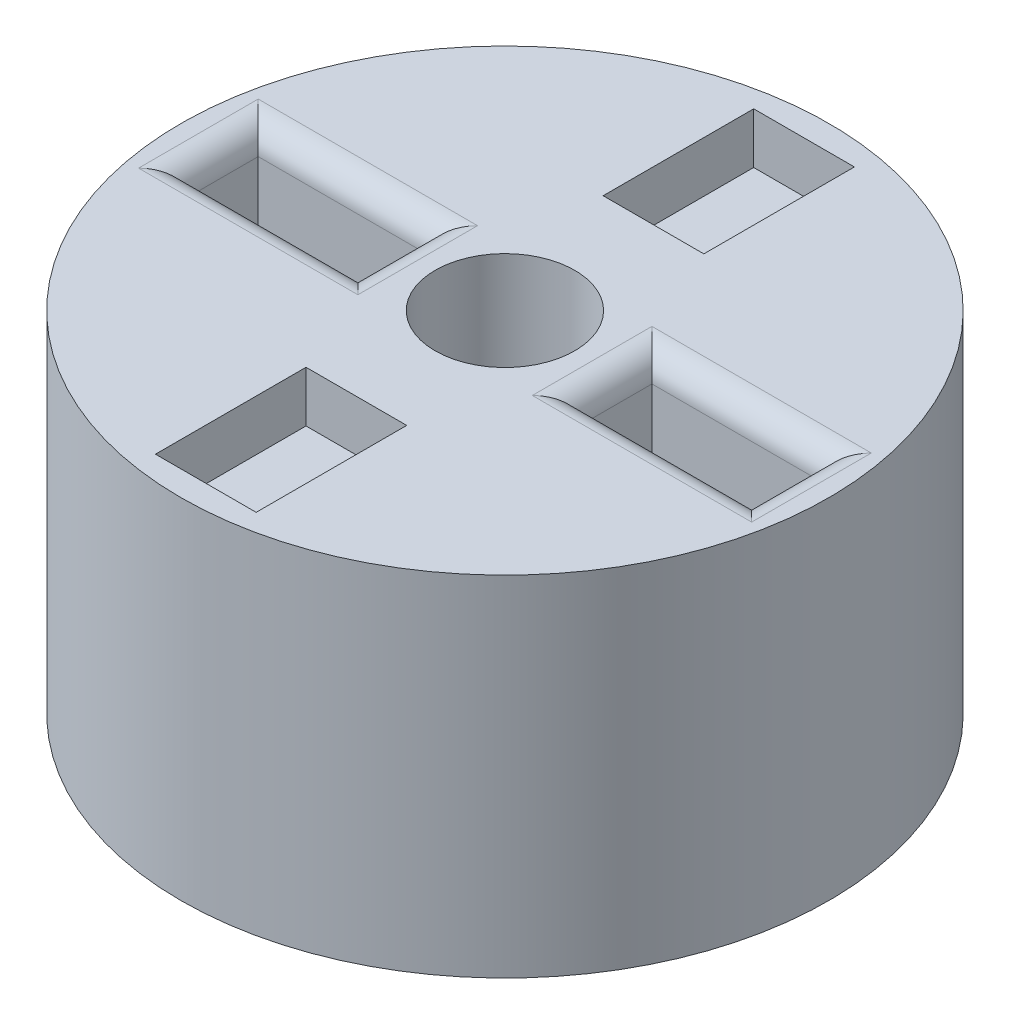
from build123d import *

# Parameters (mm, degrees)
SKETCH1_R           = 32.5
BOSS_EXTRUDE1_DEPTH = 35
SKETCH2_W           = 10.1
SKETCH2_H           = 15.1
CUT_EXTRUDE1_DEPTH  = 5.1
SKETCH3_R           = 7
CUT_EXTRUDE2_DEPTH  = 58.771100041
SKETCH4_W           = 17
SKETCH4_H           = 7
CUT_EXTRUDE3_DEPTH  = 15
FILLET1_R           = 2.5


with BuildPart() as part:
    # Sketch1 → Boss-Extrude1 (new body)
    with BuildSketch(Plane(origin=(0, 0, 0), x_dir=(1, 0, 0), z_dir=(0, 1, 0))):
        with Locations(Location((0, 0, 0), (0, 0, 270))):
            Circle(SKETCH1_R)
    extrude(amount=BOSS_EXTRUDE1_DEPTH)

    # Sketch2 → Cut-Extrude1 (cut)
    with BuildSketch(Plane(origin=(0, 35, 0), x_dir=(1, 0, 0), z_dir=(0, 1, 0))):
        with Locations((0, 22.45)):
            Rectangle(SKETCH2_W, SKETCH2_H)
        with Locations((0, -22.45)):
            Rectangle(SKETCH2_W, SKETCH2_H)
    extrude(amount=-CUT_EXTRUDE1_DEPTH, mode=Mode.SUBTRACT)

    # Sketch3 → Cut-Extrude2 (cut, through all)
    with BuildSketch(Plane(origin=(0, 35, 0), x_dir=(1, 0, 0), z_dir=(0, 1, 0))):
        with Locations(Location((0, 0, 0), (0, 0, 270))):
            Circle(SKETCH3_R)
    extrude(amount=-CUT_EXTRUDE2_DEPTH, mode=Mode.SUBTRACT)

    # Sketch4 → Cut-Extrude3 (cut)
    with BuildSketch(Plane(origin=(0, 35, 0), x_dir=(1, 0, 0), z_dir=(0, 1, 0))):
        with Locations((19.746175473, 0)):
            Rectangle(SKETCH4_W, SKETCH4_H)
        with Locations((-19.746175473, 0)):
            Rectangle(SKETCH4_W, SKETCH4_H)
    extrude(amount=-CUT_EXTRUDE3_DEPTH, mode=Mode.SUBTRACT)

    # Fillet1
    fillet1_edges = [part.edges().sort_by_distance(p)[0] for p in [
        (28.246175473, 35, 0),
        (19.746175473, 35, -3.5),
        (11.246175473, 35, 0),
        (19.746175473, 35, 3.5),
        (-19.746175473, 35, 3.5),
        (-11.246175473, 35, 0),
        (-19.746175473, 35, -3.5),
        (-28.246175473, 35, 0),
    ]]
    fillet(fillet1_edges, radius=FILLET1_R)


solid = part.part
